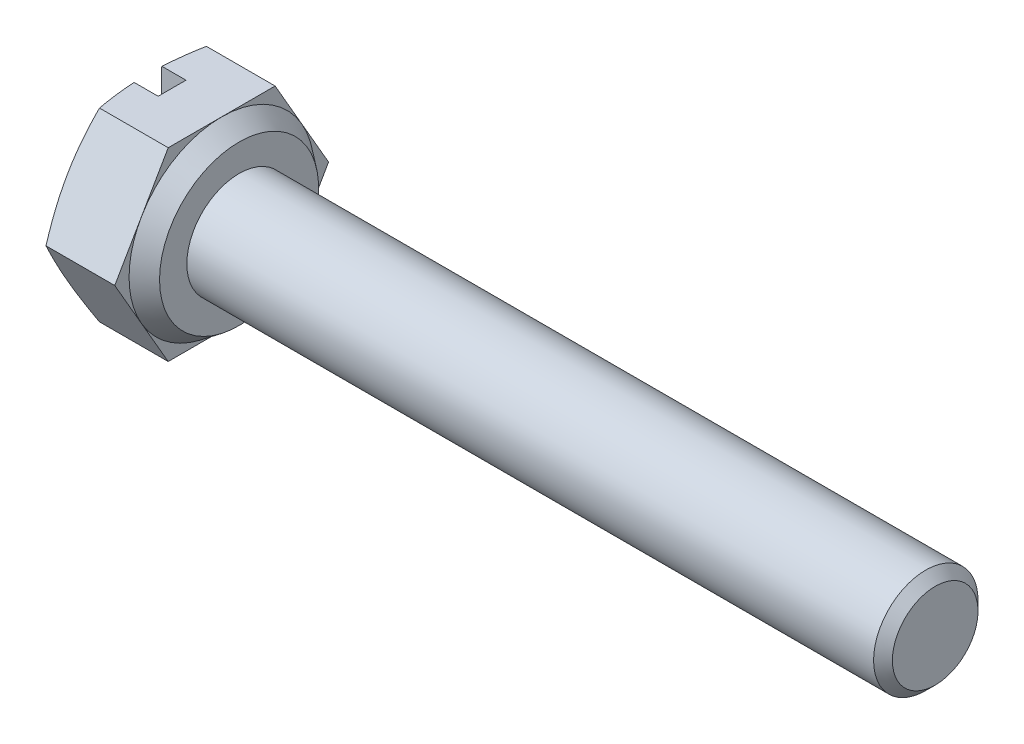
from build123d import *

# Parameters (mm, degrees)
BASEHEAD_DEPTH  = 2.125
SKETCH3_R       = 1.5
BASEBODY_DEPTH  = 20
CHAMFER1_SIZE   = 0.2705
SLOT_DEPTH      = 23.986960615
SLOT_DEPTH_BACK = 23.986960615
SKETCH5_W       = 0.7
SKETCH5_H       = 0.8


with BuildPart() as part:
    # Sketch-BaseHead → BaseHead (new body)
    with BuildSketch(Plane(origin=(0, 0, 0), x_dir=(0, 0, -1), z_dir=(1, 0, 0))):
        Polygon((1.535751716, -2.66), (3.071503432, 0), (1.535751716, 2.66), (-1.535751716, 2.66), (-3.071503432, 0), (-1.535751716, -2.66), align=None)
    extrude(amount=BASEHEAD_DEPTH)

    # Sketch1 → Revolve1 (revolve)
    with BuildSketch(Plane.XY, mode=Mode.PRIVATE) as revolve1_sk:
        Polygon((2.125, 0), (2.625, 0), (2.625, -2.285), (2.125, -2.66), align=None)
    revolve(revolve1_sk.sketch.rotate(Axis((-4.001564945, 0, 0), (1, 0, 0)), 270), axis=Axis((-4.001564945, 0, 0), (1, 0, 0)))

    # Sketch3 → BaseBody (add)
    with BuildSketch(Plane(origin=(2.625, 0, 0), x_dir=(0, 0, -1), z_dir=(1, 0, 0))):
        Circle(SKETCH3_R)
    extrude(amount=BASEBODY_DEPTH)

    # Chamfer1
    chamfer1_edges = [part.edges().sort_by_distance(p)[0] for p in [
        (22.625, 0, 1.5),
    ]]
    chamfer(chamfer1_edges, length=CHAMFER1_SIZE)

    # Sketch4 → HeadChamfer (revolve, cut)
    with BuildSketch(Plane(origin=(-0.264637255, 0, 5.916896391), x_dir=(0, 0, -1), z_dir=(0, 1, 0)), mode=Mode.PRIVATE) as headchamfer_sk:
        Polygon((8.988399823, -0.264637255), (8.576896391, -0.264637255), (8.988399823, -0.414412256), align=None)
    revolve(headchamfer_sk.sketch.rotate(Axis((-4.001564945, 0, 0), (1, 0, 0)), 180), axis=Axis((-4.001564945, 0, 0), (1, 0, 0)), mode=Mode.SUBTRACT)

    # Sketch5 → Slot (cut, two sides: drawn at the far end of the back side and taken through both)
    with BuildSketch(Plane(origin=(0, 0, 0), x_dir=(1, 0, 0), z_dir=(0, 1, 0)).offset(-SLOT_DEPTH_BACK)):
        with Locations((0.35, 0)):
            Rectangle(SKETCH5_W, SKETCH5_H)
    extrude(amount=SLOT_DEPTH + SLOT_DEPTH_BACK, mode=Mode.SUBTRACT)


solid = part.part
